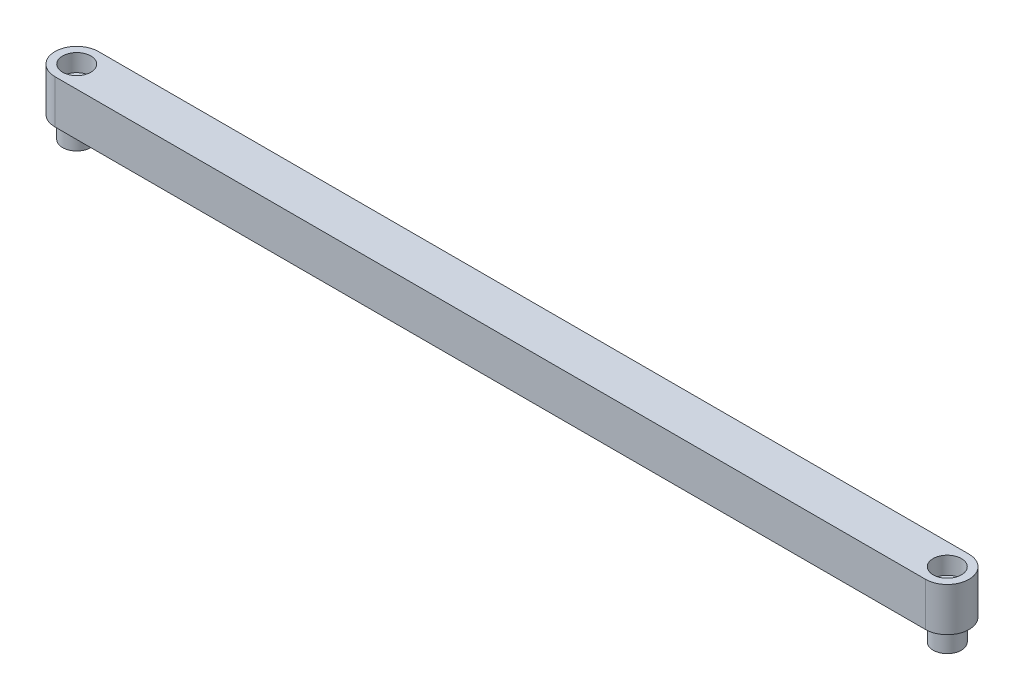
from build123d import *

# Parameters (mm, degrees)
BOSS_EXTRUDE1_DEPTH = 15
SKETCH3_R           = 9.75
CUT_EXTRUDE2_DEPTH  = 616.365744903
BOSS_EXTRUDE2_START = -30
SKETCH3_3_R         = 9.75
BOSS_EXTRUDE2_DEPTH = 30
SKETCH3_4_R         = 9.75
BOSS_EXTRUDE3_DEPTH = 3


with BuildPart() as part:
    # Sketch1 → Boss-Extrude1 (new, symmetric)
    with BuildSketch(Plane(origin=(0, 0, 0), x_dir=(1, 0, 0), z_dir=(0, 1, 0))):
        with BuildLine():
            Line((0, 15), (600, 15))
            ThreePointArc((600, 15), (615, 0), (600, -15))
            Line((600, -15), (0, -15))
            ThreePointArc((0, -15), (-15, 0), (0, 15))
        make_face()
    extrude(amount=BOSS_EXTRUDE1_DEPTH, both=True)

    # Sketch3 → Cut-Extrude2 (cut, through all)
    with BuildSketch(Plane(origin=(0, 0, 0), x_dir=(1, 0, 0), z_dir=(0, 1, 0))):
        Circle(SKETCH3_R)
        with Locations((600, 0)):
            Circle(SKETCH3_R)
    extrude(amount=CUT_EXTRUDE2_DEPTH, mode=Mode.SUBTRACT)

    # Sketch3<3> → Boss-Extrude2 (add)
    with BuildSketch(Plane(origin=(0, 0, 0), x_dir=(1, 0, 0), z_dir=(0, 1, 0)).offset(BOSS_EXTRUDE2_START)):
        Circle(SKETCH3_3_R)
        with Locations((600, 0)):
            Circle(SKETCH3_3_R)
    extrude(amount=BOSS_EXTRUDE2_DEPTH)

    # Sketch3<4> → Boss-Extrude3 (add)
    with BuildSketch(Plane(origin=(0, 0, 0), x_dir=(1, 0, 0), z_dir=(0, 1, 0))):
        Circle(SKETCH3_4_R)
        with Locations((600, 0)):
            Circle(SKETCH3_4_R)
    extrude(amount=BOSS_EXTRUDE3_DEPTH)


solid = part.part
